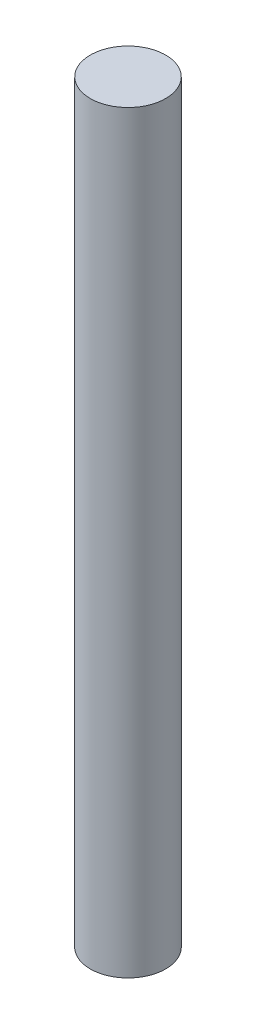
from build123d import *

# Parameters (mm, degrees)
SKETCH_2_W = 5
SKETCH_2_H = 100


with BuildPart() as part:
    # 草图2 → 旋转2 (revolve)
    with BuildSketch(Plane(origin=(0, 0, 0), x_dir=(0, 0, -1), z_dir=(1, 0, 0)), mode=Mode.PRIVATE) as revolve_2_sk:
        Rectangle(SKETCH_2_W, SKETCH_2_H)
    revolve(revolve_2_sk.sketch.rotate(Axis((0, 50, 2.5), (0, -1, 0)), 180), axis=Axis((0, 50, 2.5), (0, -1, 0)))


solid = part.part
